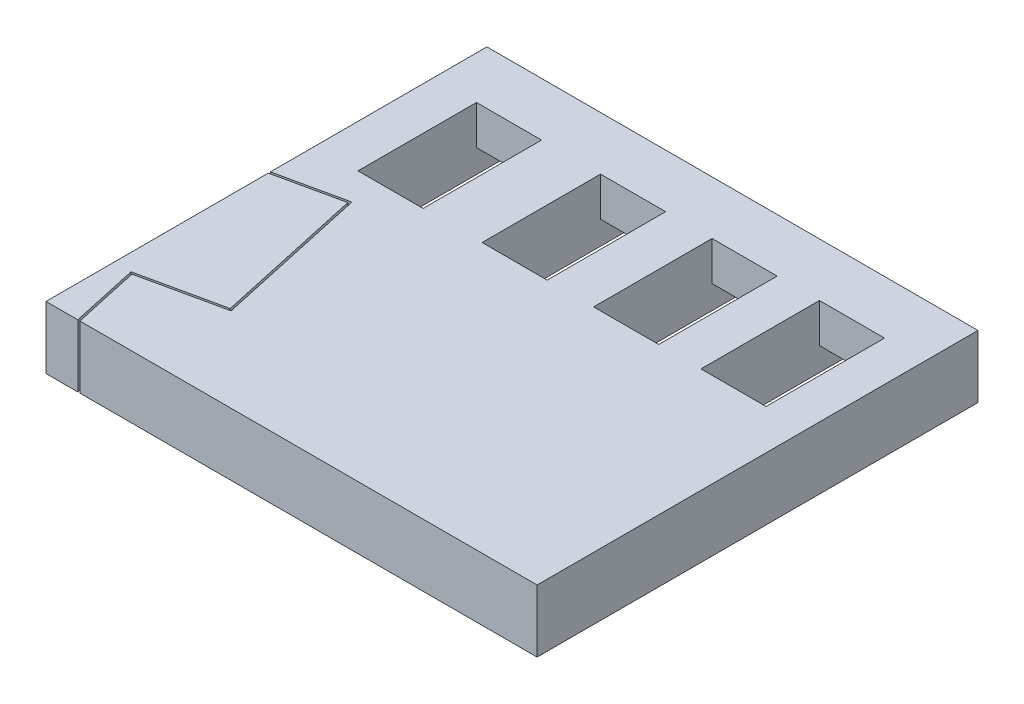
from build123d import *

# Parameters (mm, degrees)
BOSS_EXTRUDE1_START          = 8
SKETCH24_W                   = 94.322539244
SKETCH24_H                   = 12
BOSS_EXTRUDE1_DEPTH          = 84.68
CUT_EXTRUDE1_DEPTH           = 123.597068624
CUT_EXTRUDE1_DEPTH_BACK      = 123.597068624
SKETCH25_W                   = 12.5
SKETCH25_H                   = 22.75
CUT_EXTRUDE2_START           = -8.25
SKETCH25_5_W                 = 12.5
SKETCH25_5_H                 = 32.05
CUT_EXTRUDE2_DEPTH           = 4.5
CUT_EXTRUDE_THIN1_DEPTH      = 123.597068624
CUT_EXTRUDE_THIN1_DEPTH_BACK = 123.597068624


with BuildPart() as part:
    # Sketch24 → Boss-Extrude1 (new body)
    with BuildSketch(Plane.XY.offset(BOSS_EXTRUDE1_START)):
        with Locations((32.666021045, -2.25)):
            Rectangle(SKETCH24_W, SKETCH24_H)
    extrude(amount=BOSS_EXTRUDE1_DEPTH)

    # Sketch25 → Cut-Extrude1 (cut, two sides: drawn at the far end of the back side and taken through both)
    with BuildSketch(Plane(origin=(0, 0, 0), x_dir=(1, 0, 0), z_dir=(0, 1, 0)).offset(-CUT_EXTRUDE1_DEPTH_BACK)):
        with Locations((0, -29.625)):
            Rectangle(SKETCH25_W, SKETCH25_H)
        with Locations((23.832958, -29.625)):
            Rectangle(SKETCH25_W, SKETCH25_H)
        with Locations((45.252958, -29.625)):
            Rectangle(SKETCH25_W, SKETCH25_H)
        with Locations((65.876479, -29.625)):
            Rectangle(SKETCH25_W, SKETCH25_H)
    extrude(amount=CUT_EXTRUDE1_DEPTH + CUT_EXTRUDE1_DEPTH_BACK, mode=Mode.SUBTRACT)

    # Sketch25<5> → Cut-Extrude2 (cut)
    with BuildSketch(Plane(origin=(0, 0, 0), x_dir=(1, 0, 0), z_dir=(0, 1, 0)).offset(CUT_EXTRUDE2_START)):
        with Locations((0, -29.625)):
            Rectangle(SKETCH25_5_W, SKETCH25_5_H)
        with Locations((23.832958, -29.625)):
            Rectangle(SKETCH25_5_W, SKETCH25_5_H)
        with Locations((45.252958, -29.625)):
            Rectangle(SKETCH25_5_W, SKETCH25_5_H)
        with Locations((65.876479, -29.625)):
            Rectangle(SKETCH25_5_W, SKETCH25_5_H)
    extrude(amount=CUT_EXTRUDE2_DEPTH, mode=Mode.SUBTRACT)

    # Sketch30 → Cut-Extrude-Thin1 (cut, two sides: drawn at the far end of the back side and taken through both)
    with BuildSketch(Plane(origin=(0, 0, 0), x_dir=(1, 0, 0), z_dir=(0, 1, 0)).offset(-CUT_EXTRUDE_THIN1_DEPTH_BACK)):
        Polygon((-22.402588905, -28.615435543), (-17.58089022, -50.665808361), (-1.950220608, -47.247889774), (4.372928778, -76.164628557), (-11.257740834, -79.582547144), (-6.330432598, -102.115888754), (-5.939665858, -102.030440789), (-10.781526129, -79.88786592), (4.849143483, -76.469947333), (-1.644901832, -46.771675069), (-17.275571445, -50.189593656), (-22.011822165, -28.529987578), align=None)
    extrude(amount=CUT_EXTRUDE_THIN1_DEPTH + CUT_EXTRUDE_THIN1_DEPTH_BACK, mode=Mode.SUBTRACT)


with BuildPart() as cut_extrude_thin1_piece_1:
    # of the separate pieces the step leaves, piece 1, a body of its own (cut_extrude_thin1_pieces)
    add(part.part.solids().sort_by_distance((-14.495248577, 3.75, 8))[0])


with BuildPart() as cut_extrude_thin1_piece_2:
    # of the separate pieces the step leaves, piece 2, a body of its own (cut_extrude_thin1_pieces)
    add(part.part.solids().sort_by_distance((-1.950220608, 3.75, 47.247889774))[0])


solid = Compound([cut_extrude_thin1_piece_1.part, cut_extrude_thin1_piece_2.part])
